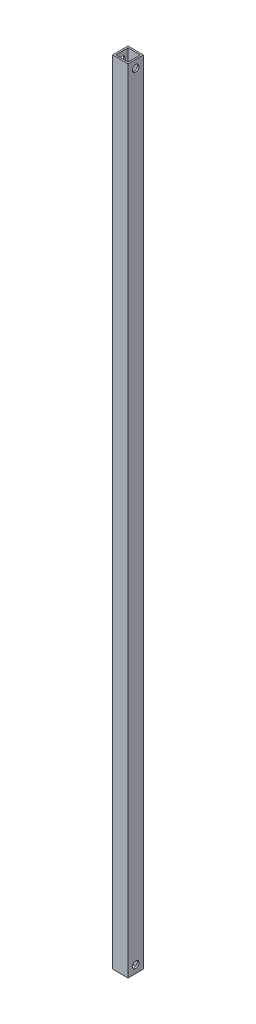
from build123d import *

# Parameters (mm, degrees)
SKETCH_1_W          = 10
SKETCH_1_H          = 10
SKETCH_1_W_2        = 8
SKETCH_1_H_2        = 8
EXTRUDE_1_DEPTH     = 513.21590794
SKETCH_4_R          = 2.15
CUT_EXTRUDE_2_DEPTH = 514.337674599


with BuildPart() as part:
    # ｽｹｯﾁ1 → 押し出し-薄板1 (new body)
    with BuildSketch(Plane(origin=(0, 0, 0), x_dir=(1, 0, 0), z_dir=(0, 1, 0))):
        Rectangle(SKETCH_1_W, SKETCH_1_H)
        Rectangle(SKETCH_1_W_2, SKETCH_1_H_2, mode=Mode.SUBTRACT)
    extrude(amount=EXTRUDE_1_DEPTH)

    # ｽｹｯﾁ4 → ｶｯﾄ - 押し出し2 (cut, through all)
    with BuildSketch(Plane.ZY.offset(-5)):
        with Locations(Location((0, 508.21590794, 0), (0, 0, 180))):
            Circle(SKETCH_4_R)
        with Locations(Location((0, 5, 0), (0, 0, 180))):
            Circle(SKETCH_4_R)
    extrude(amount=CUT_EXTRUDE_2_DEPTH, mode=Mode.SUBTRACT)


solid = part.part
